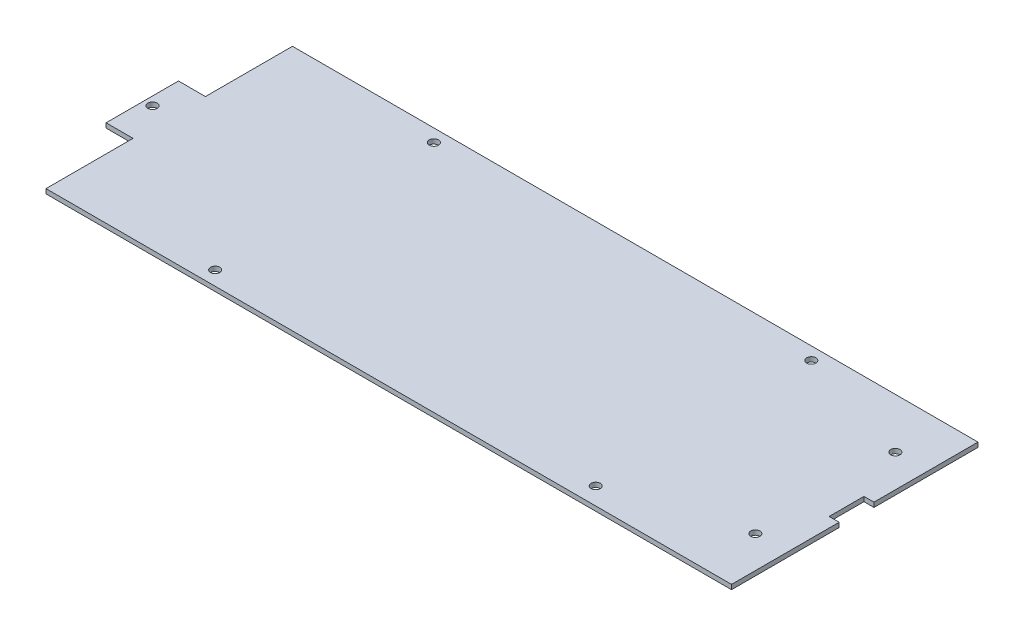
from build123d import *

# Parameters (mm, degrees)
BOSS_EXTRUDE1_START = 2
SKETCH1_R           = 3
SKETCH1_R_2         = 3.000000004
SKETCH1_R_3         = 2.999999993
BOSS_EXTRUDE1_DEPTH = 3


with BuildPart() as part:
    # Sketch1 → Boss-Extrude1 (new body)
    with BuildSketch(Plane(origin=(0, 0, 0), x_dir=(1, 0, 0), z_dir=(0, 1, 0)).offset(BOSS_EXTRUDE1_START)):
        Polygon((-302.235528935, -755.752958265), (-284.735528935, -755.752958265), (-284.735528935, -699.252958265), (160.264471065, -699.252958265), (160.264471065, -766.790866852), (153.764471065, -766.790866852), (153.764471065, -789.390866852), (160.264471065, -789.390866852), (160.264471065, -859.252958265), (-284.735528935, -859.252958265), (-284.735528935, -802.752958265), (-302.235528935, -802.752958265), align=None)
        with Locations(Location((-296.74646616, -778.09086684, 0), (0, 0, 270))):
            Circle(SKETCH1_R, mode=Mode.SUBTRACT)
        with Locations(Location((139.102370463, -731.752958265, 0), (0, 0, 270))):
            Circle(SKETCH1_R_2, mode=Mode.SUBTRACT)
        with Locations(Location((139.486711965, -823.034841954, 0), (0, 0, 270))):
            Circle(SKETCH1_R, mode=Mode.SUBTRACT)
        with Locations(Location((-184.735528935, -707.46118256, 0), (0, 0, 270))):
            Circle(SKETCH1_R_2, mode=Mode.SUBTRACT)
        with Locations(Location((60.264471065, -707.46118256, 0), (0, 0, 270))):
            Circle(SKETCH1_R_2, mode=Mode.SUBTRACT)
        with Locations(Location((60.856164784, -847.989637054, 0), (0, 0, 270))):
            Circle(SKETCH1_R, mode=Mode.SUBTRACT)
        with Locations(Location((-184.135148537, -850.052740812, 0), (0, 0, 270))):
            Circle(SKETCH1_R_3, mode=Mode.SUBTRACT)
    extrude(amount=BOSS_EXTRUDE1_DEPTH)


solid = part.part
